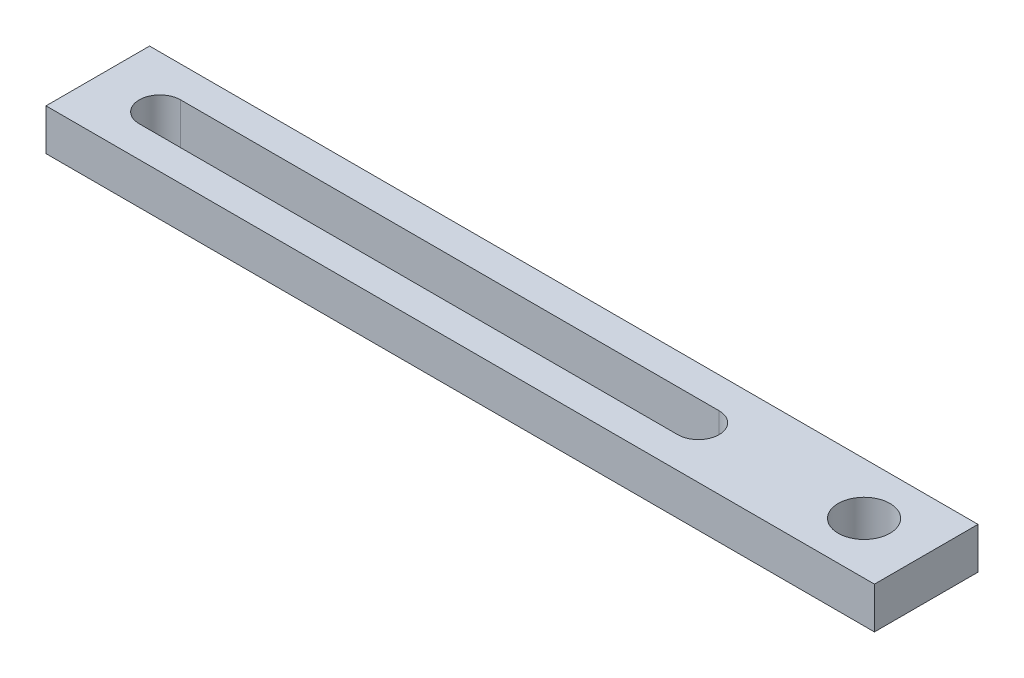
from build123d import *

# Parameters (mm, degrees)
SKETCH1_W           = 254
SKETCH1_H           = 31.75
SKETCH1_R           = 7.9375
BOSS_EXTRUDE1_DEPTH = 12.7


with BuildPart() as part:
    # Sketch1 → Boss-Extrude1 (new body)
    with BuildSketch(Plane(origin=(0, 0, 0), x_dir=(1, 0, 0), z_dir=(0, 1, 0))):
        with Locations((-127, -15.875)):
            Rectangle(SKETCH1_W, SKETCH1_H)
        with Locations(Location((-19.05, -15.875, 0), (0, 0, 270))):
            Circle(SKETCH1_R, mode=Mode.SUBTRACT)
        with BuildLine():
            Line((-234.95, -9.525), (-69.85, -9.525))
            ThreePointArc((-69.85, -9.525), (-63.5, -15.875), (-69.85, -22.225))
            Line((-69.85, -22.225), (-234.95, -22.225))
            ThreePointArc((-234.95, -22.225), (-241.3, -15.875), (-234.95, -9.525))
        make_face(mode=Mode.SUBTRACT)
    extrude(amount=BOSS_EXTRUDE1_DEPTH)


solid = part.part
